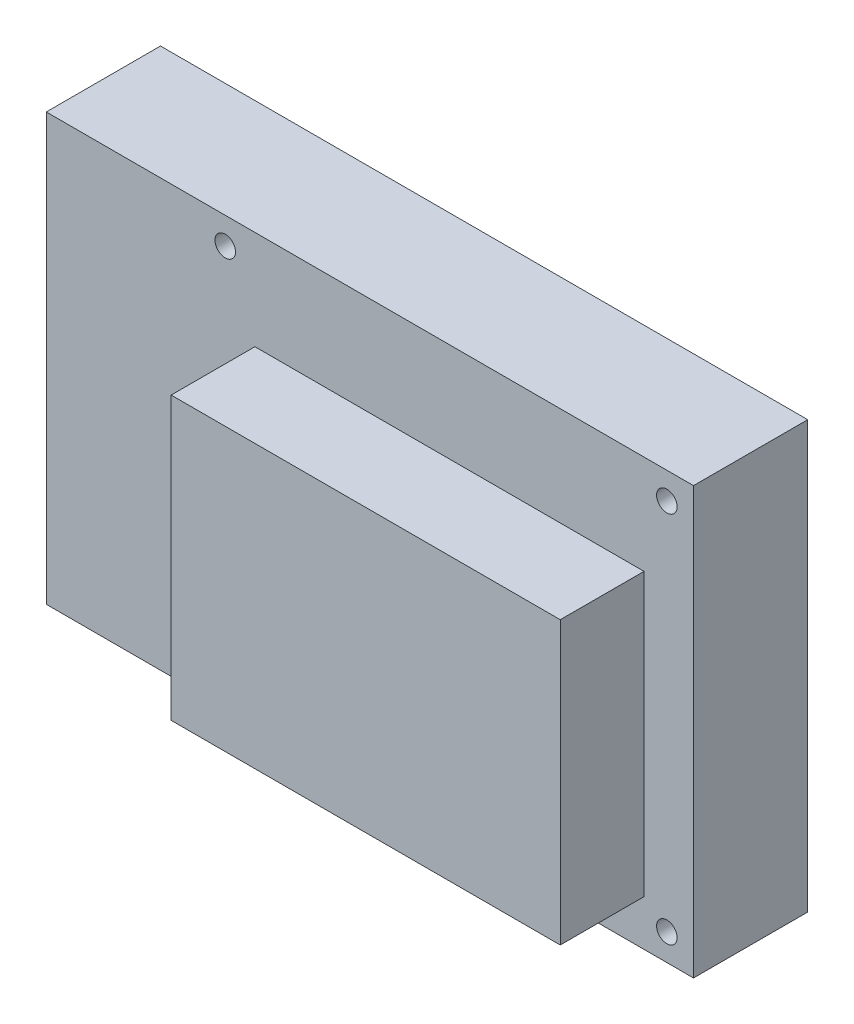
from build123d import *

# Parameters (mm, degrees)
SKETCH_1_W      = 85
SKETCH_1_H      = 56
SKETCH_1_R      = 1.35
EXTRUDE_1_DEPTH = 15
SKETCH_2_W      = 51.1
SKETCH_2_H      = 37
EXTRUDE_2_DEPTH = 11


with BuildPart() as part:
    # 草图1 → 凸台-拉伸1 (new body)
    with BuildSketch(Plane.XY):
        with Locations((-42.5, 28)):
            Rectangle(SKETCH_1_W, SKETCH_1_H)
        with Locations((-3.5, 52.5)):
            Circle(SKETCH_1_R, mode=Mode.SUBTRACT)
        with Locations((-3.5, 3.5)):
            Circle(SKETCH_1_R, mode=Mode.SUBTRACT)
        with Locations((-61.5, 3.5)):
            Circle(SKETCH_1_R, mode=Mode.SUBTRACT)
        with Locations((-61.5, 52.5)):
            Circle(SKETCH_1_R, mode=Mode.SUBTRACT)
    extrude(amount=EXTRUDE_1_DEPTH)

    # 草图2 → 凸台-拉伸2 (add)
    with BuildSketch(Plane.XY.offset(15)):
        with Locations((-32.05, 24.5)):
            Rectangle(SKETCH_2_W, SKETCH_2_H)
    extrude(amount=EXTRUDE_2_DEPTH)


solid = part.part
